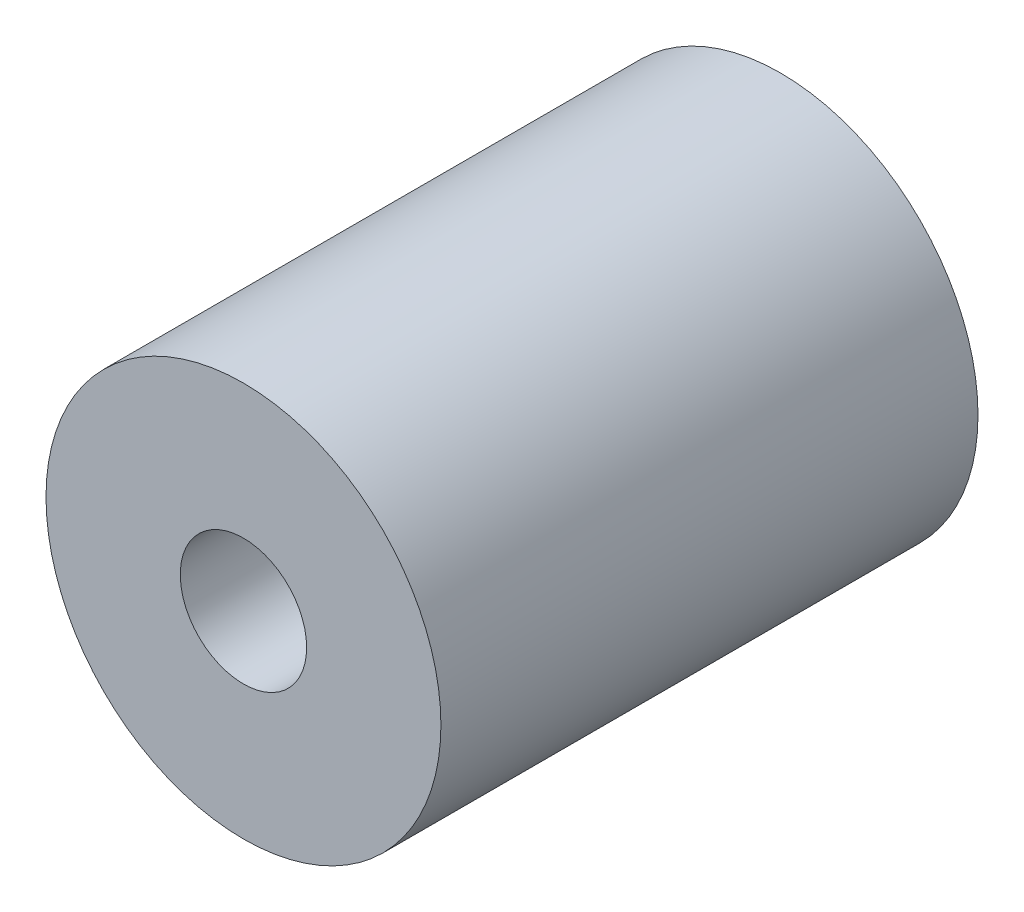
from build123d import *

# Parameters (mm, degrees)
SKIZZE1_R                       = 12.5
AUFSATZ_LINEAR_AUSTRAGEN1_DEPTH = 34
SKIZZE2_R                       = 4
SCHNITT_LINEAR_AUSTRAGEN1_DEPTH = 12
SKIZZE3_R                       = 6
SCHNITT_LINEAR_AUSTRAGEN2_DEPTH = 12


with BuildPart() as part:
    # Skizze1 → Aufsatz-Linear austragen1 (new body)
    with BuildSketch(Plane.XY):
        Circle(SKIZZE1_R)
    extrude(amount=AUFSATZ_LINEAR_AUSTRAGEN1_DEPTH)

    # Skizze2 → Schnitt-Linear austragen1 (cut)
    with BuildSketch(Plane.XY.offset(34)):
        Circle(SKIZZE2_R)
    extrude(amount=-SCHNITT_LINEAR_AUSTRAGEN1_DEPTH, mode=Mode.SUBTRACT)

    # Skizze3 → Schnitt-Linear austragen2 (cut)
    with BuildSketch(Plane(origin=(0, 0, 0), x_dir=(-1, 0, 0), z_dir=(0, 0, -1))):
        Circle(SKIZZE3_R)
    extrude(amount=-SCHNITT_LINEAR_AUSTRAGEN2_DEPTH, mode=Mode.SUBTRACT)


solid = part.part
